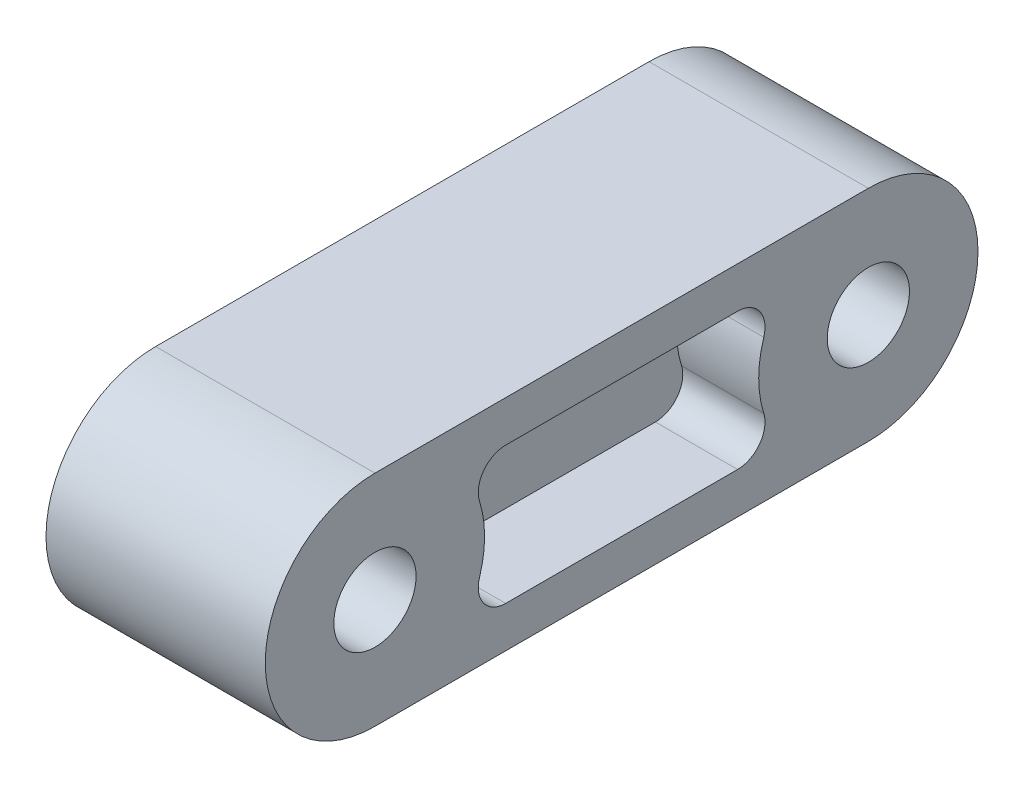
from build123d import *

# Parameters (mm, degrees)
SKETCH_1_R          = 1.5
EXTRUDE_1_DEPTH     = 4
CUT_EXTRUDE_1_DEPTH = 3
FILLET_1_R          = 1


with BuildPart() as part:
    # 草图1 → 凸台-拉伸1 (new, symmetric)
    with BuildSketch(Plane(origin=(0, 0, 0), x_dir=(0, 0, -1), z_dir=(1, 0, 0))):
        with BuildLine():
            Line((0, 4), (18, 4))
            ThreePointArc((18, 4), (22, 0), (18, -4))
            Line((18, -4), (0, -4))
            ThreePointArc((0, -4), (-4, 0), (0, 4))
        make_face()
        Circle(SKETCH_1_R, mode=Mode.SUBTRACT)
        with Locations((18, 0)):
            Circle(SKETCH_1_R, mode=Mode.SUBTRACT)
    extrude(amount=EXTRUDE_1_DEPTH, both=True)

    # 草图2 → 切除-拉伸1 (cut)
    with BuildSketch(Plane(origin=(4, 0, 0), x_dir=(0, 0, -1), z_dir=(1, 0, 0))):
        with BuildLine():
            Line((3.122498999, -2.5), (14.877501001, -2.5))
            ThreePointArc((14.877501001, -2.5), (14, 0), (14.877501001, 2.5))
            Line((14.877501001, 2.5), (3.122498999, 2.5))
            ThreePointArc((3.122498999, 2.5), (4, 0), (3.122498999, -2.5))
        make_face()
    cut_extrude_1 = extrude(amount=-CUT_EXTRUDE_1_DEPTH, mode=Mode.SUBTRACT)

    # 镜向1: 切除-拉伸1 across plane
    add(cut_extrude_1.mirror(Plane(origin=(0, 0, 0), x_dir=(0, 0, 1), z_dir=(1, 0, 0))), mode=Mode.SUBTRACT)

    # 圆角1
    fillet_1_edges = [part.edges().sort_by_distance(p)[0] for p in [
        (2.5, 2.5, -14.877501001),
        (2.5, -2.5, -14.877501001),
        (2.5, -2.5, -3.122498999),
        (2.5, 2.5, -3.122498999),
        (-2.5, -2.5, -14.877501001),
        (-2.5, 2.5, -14.877501001),
        (-2.5, 2.5, -3.122498999),
        (-2.5, -2.5, -3.122498999),
    ]]
    fillet(fillet_1_edges, radius=FILLET_1_R)


solid = part.part
